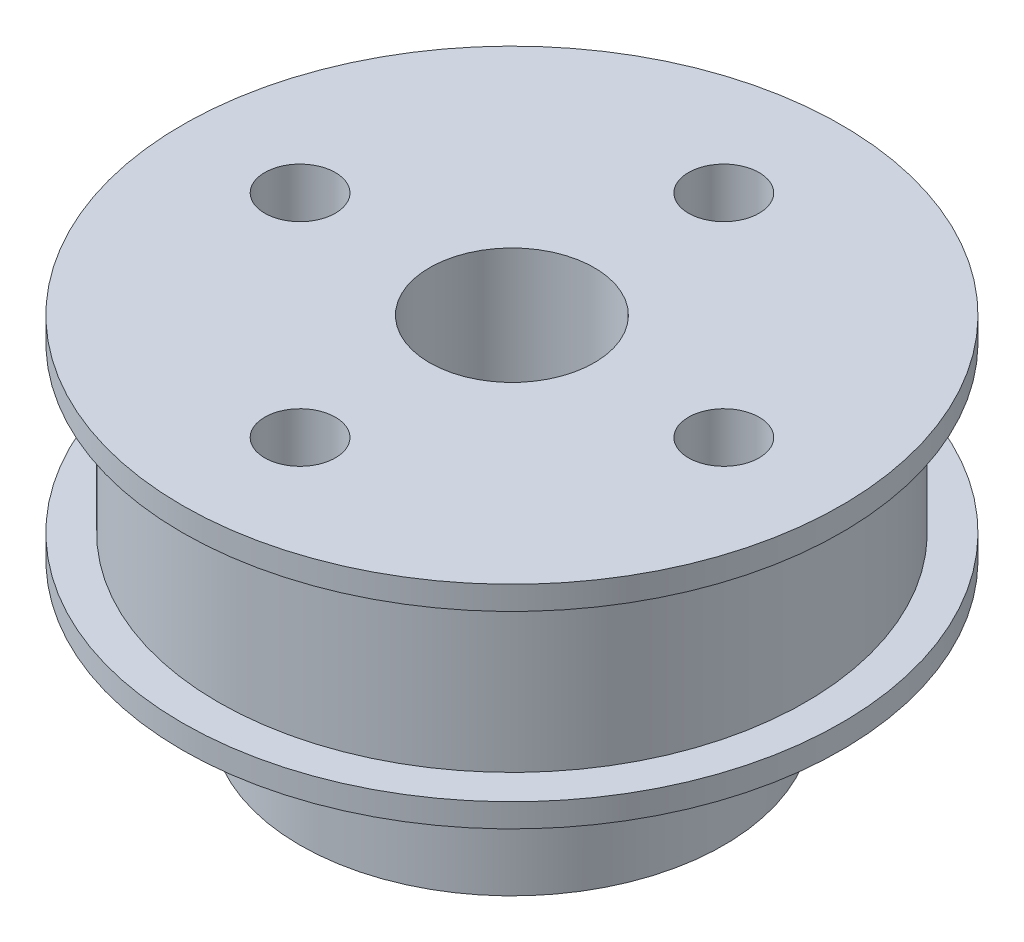
from build123d import *

# Parameters (mm, degrees)
SKETCH1_R                     = 14
BOSS_EXTRUDE1_DEPTH           = 1
SKETCH2_R                     = 12.475
BOSS_EXTRUDE2_DEPTH           = 7
SKETCH3_R                     = 14
BOSS_EXTRUDE3_DEPTH           = 1
SKETCH5_R                     = 1.5
CUT_EXTRUDE2_DEPTH            = 22.748563171
CIRPATTERN1_COUNT             = 4
SKETCH6_R                     = 9
BOSS_EXTRUDE4_DEPTH           = 6
SKETCH4_R                     = 3.5
CUT_EXTRUDE1_DEPTH            = 25.839484697
F_3_0_3_DIAMETER_HOLE1_REACH  = 33.199
F_3_0_3_DIAMETER_HOLE1_BORE_R = 1.5


with BuildPart() as part:
    # Sketch1 → Boss-Extrude1 (new body)
    with BuildSketch(Plane(origin=(0, 0, 0), x_dir=(1, 0, 0), z_dir=(0, 1, 0))):
        with Locations(Location((0, 0, 0), (0, 0, 270))):
            Circle(SKETCH1_R)
    extrude(amount=BOSS_EXTRUDE1_DEPTH)

    # Sketch2 → Boss-Extrude2 (add)
    with BuildSketch(Plane(origin=(0, 1, 0), x_dir=(1, 0, 0), z_dir=(0, 1, 0))):
        with Locations(Location((0, 0, 0), (0, 0, 270))):
            Circle(SKETCH2_R)
    extrude(amount=BOSS_EXTRUDE2_DEPTH)

    # Sketch3 → Boss-Extrude3 (add)
    with BuildSketch(Plane(origin=(0, 8, 0), x_dir=(1, 0, 0), z_dir=(0, 1, 0))):
        with Locations(Location((0, 0, 0), (0, 0, 270))):
            Circle(SKETCH3_R)
    extrude(amount=BOSS_EXTRUDE3_DEPTH)

    # Sketch5 → Cut-Extrude2 (cut, through all)
    with BuildSketch(Plane(origin=(0, 9, 0), x_dir=(1, 0, 0), z_dir=(0, 1, 0))):
        with Locations(Location((0, 9, 0), (0, 0, 270))):
            Circle(SKETCH5_R)
    cut_extrude2 = extrude(amount=-CUT_EXTRUDE2_DEPTH, mode=Mode.SUBTRACT)

    # CirPattern1: Cut-Extrude2 ×4 about axis
    cirpattern1_axis = Axis((0, 0, 0), (0, 1, 0))
    for i in range(1, CIRPATTERN1_COUNT):
        add(cut_extrude2.rotate(cirpattern1_axis, i * 360 / CIRPATTERN1_COUNT), mode=Mode.SUBTRACT)

    # Sketch6 → Boss-Extrude4 (add)
    with BuildSketch(Plane.XZ):
        with Locations(Location((0, 0, 0), (0, 0, 80.439616306))):
            Circle(SKETCH6_R)
    extrude(amount=BOSS_EXTRUDE4_DEPTH)

    # Sketch4 → Cut-Extrude1 (cut, through all)
    with BuildSketch(Plane(origin=(0, 9, 0), x_dir=(1, 0, 0), z_dir=(0, 1, 0))):
        with Locations(Location((0, 0, 0), (0, 0, 270))):
            Circle(SKETCH4_R)
    extrude(amount=-CUT_EXTRUDE1_DEPTH, mode=Mode.SUBTRACT)

    # Ø3.0 (3) Diameter Hole1 bore (on position points) → Ø3.0 (3) Diameter Hole1 (cut, up to next)
    with BuildSketch(Plane(origin=(6.342952696, -3, -6.384900242), x_dir=(-0.709433360177, 0, -0.704772521789), z_dir=(0.704772521789, 0, -0.709433360177)), mode=Mode.PRIVATE) as f_3_0_3_diameter_hole1_sk1:
        Circle(F_3_0_3_DIAMETER_HOLE1_BORE_R)
    f_3_0_3_diameter_hole1_tool1 = extrude(f_3_0_3_diameter_hole1_sk1.sketch, amount=-F_3_0_3_DIAMETER_HOLE1_REACH, mode=Mode.PRIVATE) & part.part
    add(f_3_0_3_diameter_hole1_tool1.solids().sort_by_distance((6.342953, -3, -6.3849))[0], mode=Mode.SUBTRACT)


solid = part.part
